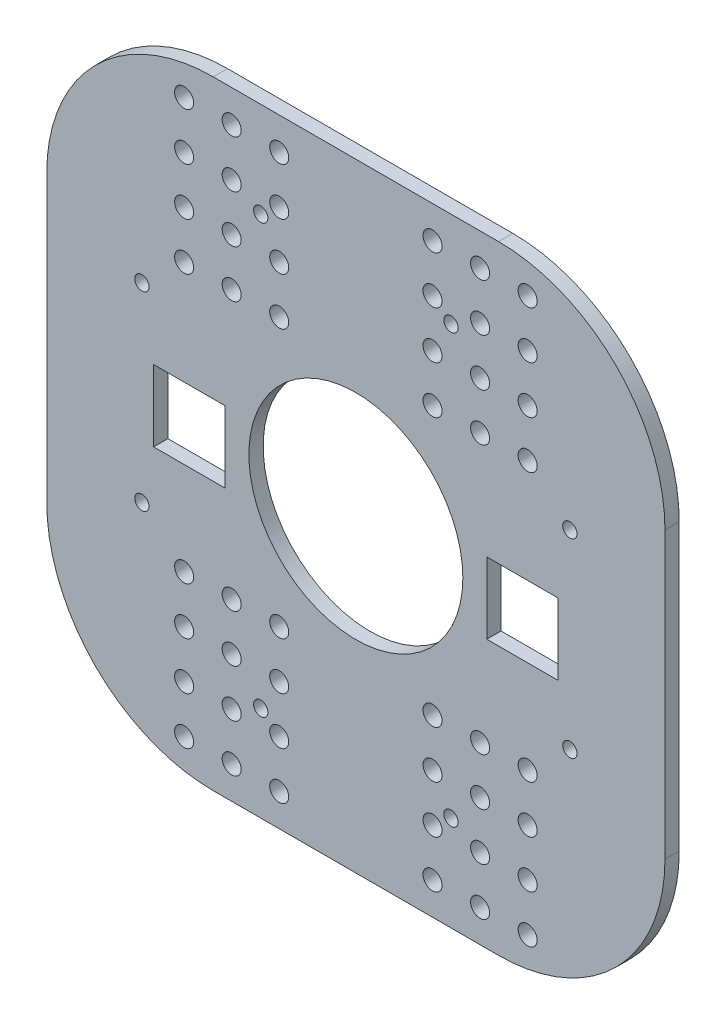
from build123d import *

# Parameters (mm, degrees)
SKETCH_1_W          = 130
SKETCH_1_H          = 130
SKETCH_1_R          = 22.5
EXTRUDE_1_DEPTH     = 3
FILLET_1_R          = 35
SKETCH_5_R          = 2
SKETCH_5_W          = 15
SKETCH_5_H          = 15
CUT_EXTRUDE_2_DEPTH = 13
SKETCH_6_R          = 1.5
CUT_EXTRUDE_3_DEPTH = 92.972822073
SKETCH_7_R          = 1.5
CUT_EXTRUDE_4_DEPTH = 92.972822073


with BuildPart() as part:
    # 草图1 → 凸台-拉伸1 (new body)
    with BuildSketch(Plane.XY):
        Rectangle(SKETCH_1_W, SKETCH_1_H)
        Circle(SKETCH_1_R, mode=Mode.SUBTRACT)
    extrude(amount=-EXTRUDE_1_DEPTH)

    # 圆角1
    fillet_1_edges = [part.edges().sort_by_distance(p)[0] for p in [
        (65, -65, -1.5),
        (-65, -65, -1.5),
        (-65, 65, -1.5),
        (65, 65, -1.5),
    ]]
    fillet(fillet_1_edges, radius=FILLET_1_R)

    # 草图5 → 切除-拉伸2 (cut)
    with BuildSketch(Plane(origin=(0, 0, -3), x_dir=(-1, 0, 0), z_dir=(0, 0, -1))):
        with Locations((36.119111303, 58.196758832)):
            Circle(SKETCH_5_R)
        with Locations((36.119111303, 48.196758832)):
            Circle(SKETCH_5_R)
        with Locations((36.119111303, 38.196758832)):
            Circle(SKETCH_5_R)
        with Locations((-36.119111303, -58.196758832)):
            Circle(SKETCH_5_R)
        with Locations((16.119111303, 48.196758832)):
            Circle(SKETCH_5_R)
        with Locations((16.119111303, 38.196758832)):
            Circle(SKETCH_5_R)
        with Locations((16.119111303, 28.196758832)):
            Circle(SKETCH_5_R)
        with Locations((26.119111303, 58.196758832)):
            Circle(SKETCH_5_R)
        with Locations((16.119111303, -48.196758832)):
            Circle(SKETCH_5_R)
        with Locations((26.119111303, -28.196758832)):
            Circle(SKETCH_5_R)
        with Locations((36.119111303, 28.196758832)):
            Circle(SKETCH_5_R)
        with Locations((26.119111303, 48.196758832)):
            Circle(SKETCH_5_R)
        with Locations((26.119111303, 38.196758832)):
            Circle(SKETCH_5_R)
        with Locations((26.119111303, 28.196758832)):
            Circle(SKETCH_5_R)
        with Locations((16.119111303, 58.196758832)):
            Circle(SKETCH_5_R)
        with Locations((16.119111303, -58.196758832)):
            Circle(SKETCH_5_R)
        with Locations((26.119111303, -58.196758832)):
            Circle(SKETCH_5_R)
        with Locations((16.119111303, -28.196758832)):
            Circle(SKETCH_5_R)
        with Locations((16.119111303, -38.196758832)):
            Circle(SKETCH_5_R)
        with Locations((36.119111303, -38.196758832)):
            Circle(SKETCH_5_R)
        with Locations((36.119111303, -48.196758832)):
            Circle(SKETCH_5_R)
        with Locations((36.119111303, -58.196758832)):
            Circle(SKETCH_5_R)
        with Locations((-36.119111303, -48.196758832)):
            Circle(SKETCH_5_R)
        with Locations((-36.119111303, -38.196758832)):
            Circle(SKETCH_5_R)
        with Locations((-16.119111303, -38.196758832)):
            Circle(SKETCH_5_R)
        with Locations((-16.119111303, -28.196758832)):
            Circle(SKETCH_5_R)
        with Locations((-26.119111303, -58.196758832)):
            Circle(SKETCH_5_R)
        with Locations((26.119111303, -38.196758832)):
            Circle(SKETCH_5_R)
        with Locations((26.119111303, -48.196758832)):
            Circle(SKETCH_5_R)
        with Locations((36.119111303, -28.196758832)):
            Circle(SKETCH_5_R)
        with Locations((-36.119111303, -28.196758832)):
            Circle(SKETCH_5_R)
        with Locations((-26.119111303, -48.196758832)):
            Circle(SKETCH_5_R)
        with Locations((-26.119111303, -38.196758832)):
            Circle(SKETCH_5_R)
        with Locations((-26.119111303, -28.196758832)):
            Circle(SKETCH_5_R)
        with Locations((-16.119111303, -48.196758832)):
            Circle(SKETCH_5_R)
        with Locations((-16.119111303, 28.196758832)):
            Circle(SKETCH_5_R)
        with Locations((-16.119111303, 38.196758832)):
            Circle(SKETCH_5_R)
        with Locations((-16.119111303, 48.196758832)):
            Circle(SKETCH_5_R)
        with Locations((-26.119111303, 28.196758832)):
            Circle(SKETCH_5_R)
        with Locations((-26.119111303, 38.196758832)):
            Circle(SKETCH_5_R)
        with Locations((-36.119111303, 38.196758832)):
            Circle(SKETCH_5_R)
        with Locations((-36.119111303, 48.196758832)):
            Circle(SKETCH_5_R)
        with Locations((-36.119111303, 58.196758832)):
            Circle(SKETCH_5_R)
        with Locations((-16.119111303, -58.196758832)):
            Circle(SKETCH_5_R)
        with Locations((-16.119111303, 58.196758832)):
            Circle(SKETCH_5_R)
        with Locations((-26.119111303, 58.196758832)):
            Circle(SKETCH_5_R)
        with Locations((-26.119111303, 48.196758832)):
            Circle(SKETCH_5_R)
        with Locations((-36.119111303, 28.196758832)):
            Circle(SKETCH_5_R)
        with Locations((35.031984266, -1.155156202)):
            Rectangle(SKETCH_5_W, SKETCH_5_H)
        with Locations((-35.031984266, -1.155156202)):
            Rectangle(SKETCH_5_W, SKETCH_5_H)
    extrude(amount=-CUT_EXTRUDE_2_DEPTH, mode=Mode.SUBTRACT)

    # 草图6 → 切除-拉伸3 (cut, through all)
    with BuildSketch(Plane.XY):
        with Locations((-45, 20)):
            Circle(SKETCH_6_R)
        with Locations((45, 20)):
            Circle(SKETCH_6_R)
        with Locations((45, -20)):
            Circle(SKETCH_6_R)
        with Locations((-45, -20)):
            Circle(SKETCH_6_R)
    extrude(amount=-CUT_EXTRUDE_3_DEPTH, mode=Mode.SUBTRACT)

    # 草图7 → 切除-拉伸4 (cut, through all)
    with BuildSketch(Plane.XY):
        with Locations((-20, 45)):
            Circle(SKETCH_7_R)
        with Locations((20, 45)):
            Circle(SKETCH_7_R)
        with Locations((20, -45)):
            Circle(SKETCH_7_R)
        with Locations((-20, -45)):
            Circle(SKETCH_7_R)
    extrude(amount=-CUT_EXTRUDE_4_DEPTH, mode=Mode.SUBTRACT)


solid = part.part
